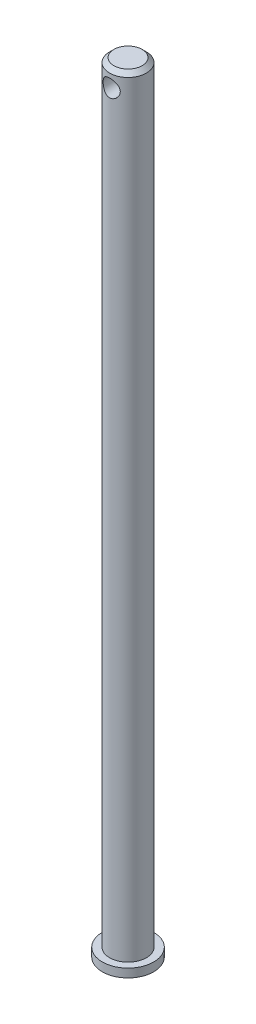
from build123d import *

# Parameters (mm, degrees)
SKETCH1_R               = 2.15
BOSS_EXTRUDE1_DEPTH     = 90
CHAMFER1_SIZE           = 0.5
SKETCH2_R               = 3
BOSS_EXTRUDE2_DEPTH     = 1
CUT_EXTRUDE1_DEPTH      = 91.099944506
CUT_EXTRUDE1_DEPTH_BACK = 91.099944506
SKETCH3_R               = 1


with BuildPart() as part:
    # Sketch1 → Boss-Extrude1 (new body)
    with BuildSketch(Plane(origin=(0, 0, 0), x_dir=(1, 0, 0), z_dir=(0, 1, 0))):
        with Locations(Location((0, 0, 0), (0, 0, 90))):
            Circle(SKETCH1_R)
    extrude(amount=BOSS_EXTRUDE1_DEPTH)

    # Chamfer1
    chamfer1_edges = [part.edges().sort_by_distance(p)[0] for p in [
        (0, 90, 2.15),
    ]]
    chamfer(chamfer1_edges, length=CHAMFER1_SIZE)

    # Sketch2 → Boss-Extrude2 (add)
    with BuildSketch(Plane(origin=(0, 0, 0), x_dir=(-1, 0, 0), z_dir=(0, -1, 0))):
        with Locations(Location((0, 0, 0), (0, 0, 90))):
            Circle(SKETCH2_R)
    extrude(amount=BOSS_EXTRUDE2_DEPTH)

    # Sketch3 → Cut-Extrude1 (cut, two sides: drawn at the far end of the back side and taken through both)
    with BuildSketch(Plane.XY.offset(-CUT_EXTRUDE1_DEPTH_BACK)):
        with Locations(Location((0, 88, 0), (0, 0, 89.999999996))):
            Circle(SKETCH3_R)
    extrude(amount=CUT_EXTRUDE1_DEPTH + CUT_EXTRUDE1_DEPTH_BACK, mode=Mode.SUBTRACT)


solid = part.part
